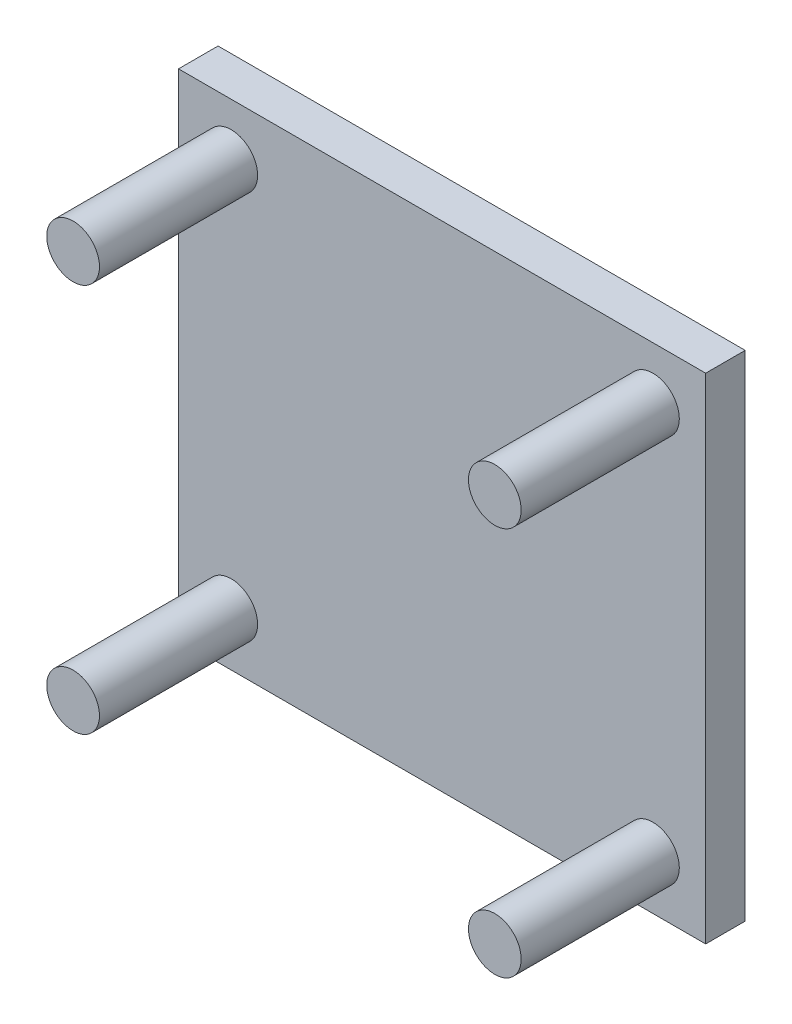
from build123d import *

# Parameters (mm, degrees)
SKETCH_1_W         = 40
SKETCH_1_H         = 37.510615526
FORMER_BASE_DEPTH  = 3
FORMER_POSTS_START = 3
SKETCH_2_R         = 2
FORMER_POSTS_DEPTH = 12


with BuildPart() as part:
    # Эскиз1 → Former_base (new body)
    with BuildSketch(Plane.XY):
        Rectangle(SKETCH_1_W, SKETCH_1_H)
    extrude(amount=FORMER_BASE_DEPTH)

    # Эскиз2 → Former_posts (add)
    with BuildSketch(Plane.XY.offset(FORMER_POSTS_START)):
        with Locations((-16, -14.755307763)):
            Circle(SKETCH_2_R)
        with Locations((-16, 14.755307763)):
            Circle(SKETCH_2_R)
        with Locations((16, -14.755307763)):
            Circle(SKETCH_2_R)
        with Locations((16, 14.755307763)):
            Circle(SKETCH_2_R)
    extrude(amount=FORMER_POSTS_DEPTH)


solid = part.part
